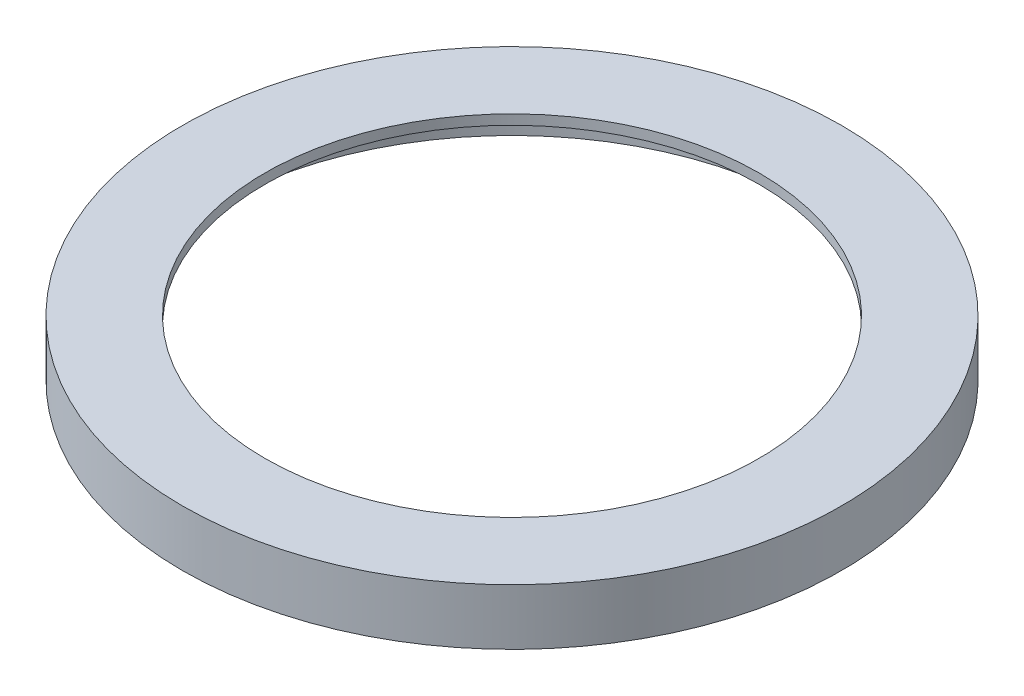
from build123d import *

# Parameters (mm, degrees)
EXTRUDE_START       = -1
SKETCH_1_R          = 100
SKETCH_1_R_2        = 75
EXTRUDE_1_DEPTH     = 17
SKETCH_5_R          = 91
CUT_EXTRUDE_1_DEPTH = 14


with BuildPart() as part:
    # Эскиз1 → Вытянуть1 (new body)
    with BuildSketch(Plane(origin=(0, 0, 0), x_dir=(1, 0, 0), z_dir=(0, 1, 0)).offset(EXTRUDE_START)):
        with Locations(Location((0, -3.103234433, 0), (0, 0, 270))):
            Circle(SKETCH_1_R)
        with Locations(Location((0, -3.103234433, 0), (0, 0, 270))):
            Circle(SKETCH_1_R_2, mode=Mode.SUBTRACT)
    extrude(amount=EXTRUDE_1_DEPTH)

    # Эскиз5 → Вырез-Вытянуть1 (cut)
    with BuildSketch(Plane.XZ.offset(1)):
        with Locations(Location((0, 3.103234433, 0), (0, 0, 270))):
            Circle(SKETCH_5_R)
    extrude(amount=-CUT_EXTRUDE_1_DEPTH, mode=Mode.SUBTRACT)


solid = part.part
